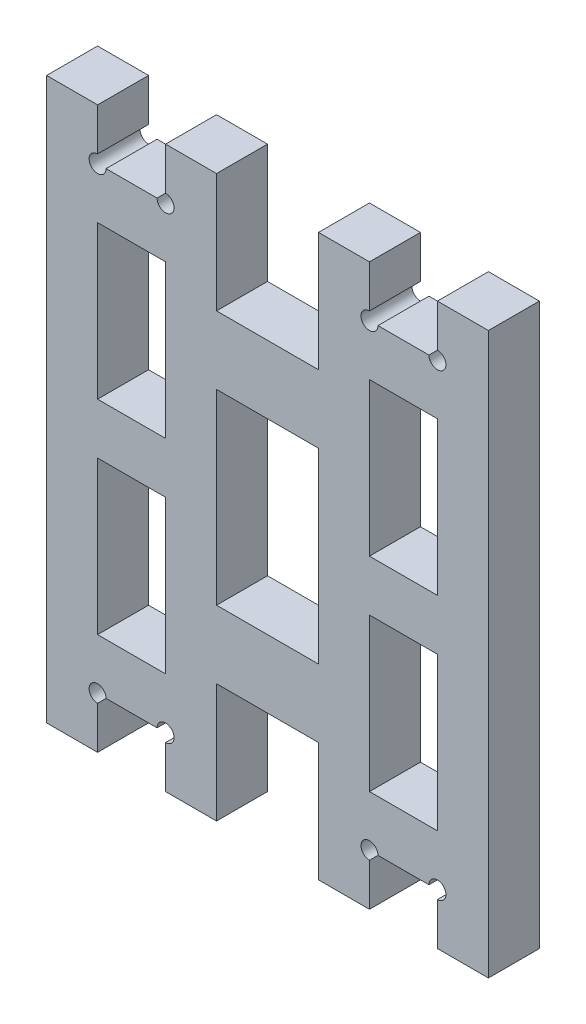
from build123d import *

# Parameters (mm, degrees)
SKETCH_1_W      = 5.999999173
SKETCH_1_H      = 10.999998182
SKETCH_1_W_2    = 4.00000019
SKETCH_1_H_2    = 8.999999777
SKETCH_1_H_3    = 9.000000708
SKETCH_1_W_3    = 4.000000656
EXTRUDE_1_DEPTH = 3


with BuildPart() as part:
    # 草图1 → 凸台-拉伸1 (new body)
    with BuildSketch(Plane.XY):
        with BuildLine():
            Line((9.999999777, 25.999999166), (9.999999777, 33.000000149))
            Line((9.999999777, 33.000000149), (7.000000216, 33.000000149))
            Line((7.000000216, 33.000000149), (7.000000216, 30.499998808))
            ThreePointArc((7.000000216, 30.499998808), (7.353551416, 29.64644555), (6.500000134, 30.00000152))
            Line((6.500000134, 30.00000152), (3.500000108, 30.00000152))
            ThreePointArc((3.500000108, 30.00000152), (2.646448658, 29.646445383), (3.000000026, 30.499998808))
            Line((3.000000026, 30.499998808), (3.000000026, 33.000000149))
            Line((3.000000026, 33.000000149), (0, 33.000000149))
            Line((0, 33.000000149), (0, 0))
            Line((0, 0), (3.000000026, 0))
            Line((3.000000026, 0), (3.000000026, 2.499999944))
            ThreePointArc((3.000000026, 2.499999944), (2.64644665, 3.353553403), (3.500000108, 3.000000026))
            Line((3.500000108, 3.000000026), (6.500000134, 3.000000026))
            ThreePointArc((6.500000134, 3.000000026), (7.353553425, 3.353553235), (7.000000216, 2.499999944))
            Line((7.000000216, 2.499999944), (7.000000216, 0))
            Line((7.000000216, 0), (9.999999777, 0))
            Line((9.999999777, 0), (9.999999777, 7.000000983))
            Line((9.999999777, 7.000000983), (16.00000076, 7.000000983))
            Line((16.00000076, 7.000000983), (16.00000076, 0))
            Line((16.00000076, 0), (18.999999389, 0))
            Line((18.999999389, 0), (18.999999389, 2.499999944))
            ThreePointArc((18.999999389, 2.499999944), (18.646447034, 3.353553971), (19.500000402, 3.000000026))
            Line((19.500000402, 3.000000026), (22.500000894, 3.000000026))
            ThreePointArc((22.500000894, 3.000000026), (23.353554637, 3.353553028), (23.000000045, 2.499999944))
            Line((23.000000045, 2.499999944), (23.000000045, 0))
            Line((23.000000045, 0), (26.000000536, 0))
            Line((26.000000536, 0), (26.000000536, 33.000000149))
            Line((26.000000536, 33.000000149), (23.000000045, 33.000000149))
            Line((23.000000045, 33.000000149), (23.000000045, 30.499998808))
            ThreePointArc((23.000000045, 30.499998808), (23.353552628, 29.646445757), (22.500000894, 30.00000152))
            Line((22.500000894, 30.00000152), (19.500000402, 30.00000152))
            ThreePointArc((19.500000402, 30.00000152), (18.646449043, 29.646444814), (18.999999389, 30.499998808))
            Line((18.999999389, 30.499998808), (18.999999389, 33.000000149))
            Line((18.999999389, 33.000000149), (16.00000076, 33.000000149))
            Line((16.00000076, 33.000000149), (16.00000076, 25.999999166))
            Line((16.00000076, 25.999999166), (9.999999777, 25.999999166))
        make_face()
        with Locations((12.999999802, 16.500000075)):
            Rectangle(SKETCH_1_W, SKETCH_1_H, mode=Mode.SUBTRACT)
        with Locations((5.000000121, 22.499999278)):
            Rectangle(SKETCH_1_W_2, SKETCH_1_H_2, mode=Mode.SUBTRACT)
        with Locations((5.000000121, 10.500000406)):
            Rectangle(SKETCH_1_W_2, SKETCH_1_H_3, mode=Mode.SUBTRACT)
        with Locations((20.999999717, 10.500000406)):
            Rectangle(SKETCH_1_W_3, SKETCH_1_H_3, mode=Mode.SUBTRACT)
        with Locations((20.999999717, 22.499999278)):
            Rectangle(SKETCH_1_W_3, SKETCH_1_H_2, mode=Mode.SUBTRACT)
    extrude(amount=EXTRUDE_1_DEPTH)


solid = part.part
